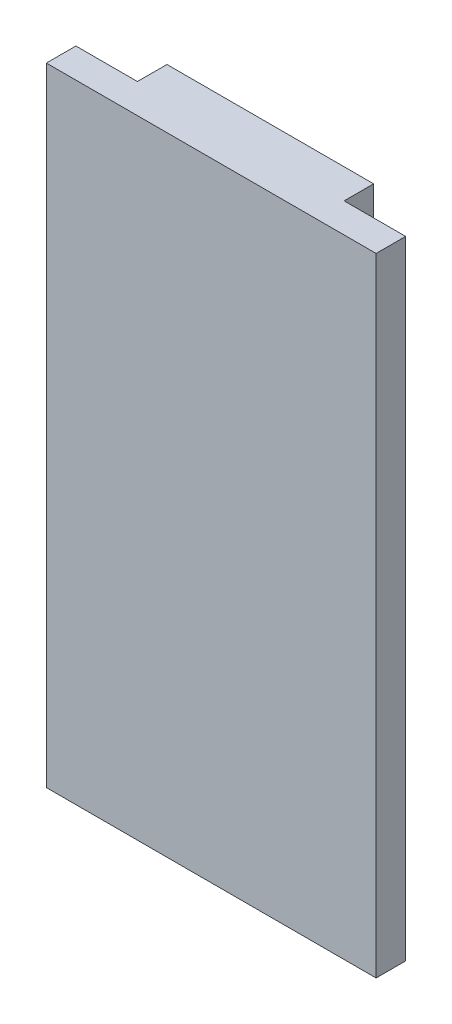
from build123d import *

# Parameters (mm, degrees)
SKETCH1_W           = 533.4
SKETCH1_H           = 1619.25
BOSS_EXTRUDE1_DEPTH = 76.2
SKETCH2_W           = 850.9
SKETCH2_H           = 1619.25
BOSS_EXTRUDE2_DEPTH = 76.2


with BuildPart() as part:
    # Sketch1 → Boss-Extrude1 (new body)
    with BuildSketch(Plane.XY):
        Rectangle(SKETCH1_W, SKETCH1_H)
    extrude(amount=BOSS_EXTRUDE1_DEPTH)

    # Sketch2 → Boss-Extrude2 (add)
    with BuildSketch(Plane.XY.offset(76.2)):
        Rectangle(SKETCH2_W, SKETCH2_H)
    extrude(amount=BOSS_EXTRUDE2_DEPTH)


solid = part.part
